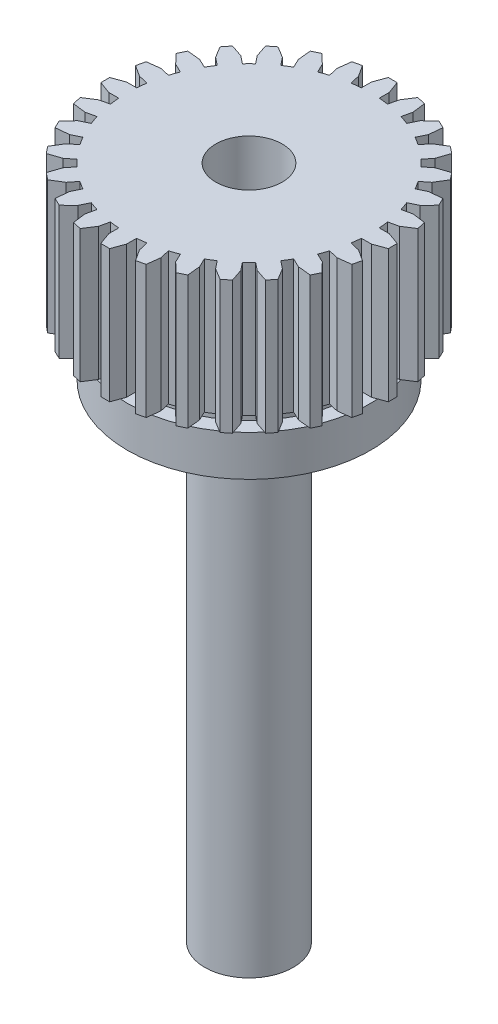
from build123d import *

# Parameters (mm, degrees)
BOSS_EXTRU_1_DEPTH                  = 3
DIAM_TRE_DU_PER_AGE_1_5_1_5_1_D     = 1.5
DIAM_TRE_DU_PER_AGE_1_5_1_5_1_DEPTH = 3


with BuildPart() as part:
    # Esquisse1 → Boss.-Extru.1 (new body)
    with BuildSketch(Plane(origin=(0, -2, 0), x_dir=(1, 0, 0), z_dir=(0, 1, 0))):
        with BuildLine():
            Line((-48.20446184, -20.015127697), (-48.502133602, -20.052430808))
            Line((-48.502133602, -20.052430808), (-48.546637789, -20.247416391))
            Line((-48.546637789, -20.247416391), (-48.294630012, -20.41018027))
            Line((-48.294630012, -20.41018027), (-48.074719557, -20.460373396))
            ThreePointArc((-48.074719557, -20.460373396), (-48.088578558, -20.565214326), (-48.098396333, -20.670510592))
            Line((-48.098396333, -20.670510592), (-48.323962195, -20.670510592))
            Line((-48.323962195, -20.670510592), (-48.605869981, -20.773116635))
            Line((-48.605869981, -20.773116635), (-48.605869981, -20.973116635))
            Line((-48.605869981, -20.973116635), (-48.323962195, -21.075722678))
            Line((-48.323962195, -21.075722678), (-48.098396333, -21.075722678))
            ThreePointArc((-48.098396333, -21.075722678), (-48.088578558, -21.181018944), (-48.074719557, -21.285859874))
            Line((-48.074719557, -21.285859874), (-48.294630012, -21.336053))
            Line((-48.294630012, -21.336053), (-48.546637789, -21.498816879))
            Line((-48.546637789, -21.498816879), (-48.502133602, -21.693802461))
            Line((-48.502133602, -21.693802461), (-48.20446184, -21.731105573))
            Line((-48.20446184, -21.731105573), (-47.984551385, -21.680912447))
            ThreePointArc((-47.984551385, -21.680912447), (-47.951549139, -21.781384055), (-47.914708311, -21.880512486))
            Line((-47.914708311, -21.880512486), (-48.11793613, -21.978381845))
            Line((-48.11793613, -21.978381845), (-48.327407175, -22.1931419))
            Line((-48.327407175, -22.1931419), (-48.240630428, -22.373335674))
            Line((-48.240630428, -22.373335674), (-47.942121195, -22.34346532))
            Line((-47.942121195, -22.34346532), (-47.738893376, -22.24559596))
            ThreePointArc((-47.738893376, -22.24559596), (-47.684361529, -22.336204845), (-47.626386226, -22.424650064))
            Line((-47.626386226, -22.424650064), (-47.802740718, -22.565288078))
            Line((-47.802740718, -22.565288078), (-47.959171279, -22.821275343))
            Line((-47.959171279, -22.821275343), (-47.834473319, -22.977641639))
            Line((-47.834473319, -22.977641639), (-47.550095115, -22.882095644))
            Line((-47.550095115, -22.882095644), (-47.373740623, -22.74145763))
            ThreePointArc((-47.373740623, -22.74145763), (-47.300413629, -22.817660283), (-47.224210976, -22.890987277))
            Line((-47.224210976, -22.890987277), (-47.36484899, -23.067341769))
            Line((-47.36484899, -23.067341769), (-47.460394985, -23.351719973))
            Line((-47.460394985, -23.351719973), (-47.304028689, -23.476417933))
            Line((-47.304028689, -23.476417933), (-47.048041424, -23.319987372))
            Line((-47.048041424, -23.319987372), (-46.90740341, -23.14363288))
            ThreePointArc((-46.90740341, -23.14363288), (-46.818958191, -23.201608183), (-46.728349306, -23.25614003))
            Line((-46.728349306, -23.25614003), (-46.826218666, -23.459367849))
            Line((-46.826218666, -23.459367849), (-46.85608902, -23.757877082))
            Line((-46.85608902, -23.757877082), (-46.675895246, -23.844653829))
            Line((-46.675895246, -23.844653829), (-46.461135191, -23.635182784))
            Line((-46.461135191, -23.635182784), (-46.363265832, -23.431954965))
            ThreePointArc((-46.363265832, -23.431954965), (-46.264137401, -23.468795793), (-46.163665793, -23.501798039))
            Line((-46.163665793, -23.501798039), (-46.213858919, -23.721708494))
            Line((-46.213858919, -23.721708494), (-46.176555807, -24.019380256))
            Line((-46.176555807, -24.019380256), (-45.981570225, -24.063884443))
            Line((-45.981570225, -24.063884443), (-45.818806346, -23.811876666))
            Line((-45.818806346, -23.811876666), (-45.76861322, -23.591966211))
            ThreePointArc((-45.76861322, -23.591966211), (-45.66377229, -23.605825212), (-45.558476024, -23.615642987))
            Line((-45.558476024, -23.615642987), (-45.558476024, -23.841208849))
            Line((-45.558476024, -23.841208849), (-45.455869981, -24.123116635))
            Line((-45.455869981, -24.123116635), (-45.255869981, -24.123116635))
            Line((-45.255869981, -24.123116635), (-45.153263938, -23.841208849))
            Line((-45.153263938, -23.841208849), (-45.153263938, -23.615642987))
            ThreePointArc((-45.153263938, -23.615642987), (-45.047967672, -23.605825212), (-44.943126742, -23.591966211))
            Line((-44.943126742, -23.591966211), (-44.892933616, -23.811876666))
            Line((-44.892933616, -23.811876666), (-44.730169737, -24.063884443))
            Line((-44.730169737, -24.063884443), (-44.535184154, -24.019380256))
            Line((-44.535184154, -24.019380256), (-44.497881043, -23.721708494))
            Line((-44.497881043, -23.721708494), (-44.548074169, -23.501798039))
            ThreePointArc((-44.548074169, -23.501798039), (-44.447602561, -23.468795793), (-44.34847413, -23.431954965))
            Line((-44.34847413, -23.431954965), (-44.25060477, -23.635182784))
            Line((-44.25060477, -23.635182784), (-44.035844716, -23.844653829))
            Line((-44.035844716, -23.844653829), (-43.855650942, -23.757877082))
            Line((-43.855650942, -23.757877082), (-43.885521296, -23.459367849))
            Line((-43.885521296, -23.459367849), (-43.983390655, -23.25614003))
            ThreePointArc((-43.983390655, -23.25614003), (-43.89278177, -23.201608183), (-43.804336552, -23.14363288))
            Line((-43.804336552, -23.14363288), (-43.663698538, -23.319987372))
            Line((-43.663698538, -23.319987372), (-43.407711273, -23.476417933))
            Line((-43.407711273, -23.476417933), (-43.251344977, -23.351719973))
            Line((-43.251344977, -23.351719973), (-43.346890972, -23.067341769))
            Line((-43.346890972, -23.067341769), (-43.487528986, -22.890987277))
            ThreePointArc((-43.487528986, -22.890987277), (-43.411326333, -22.817660283), (-43.337999339, -22.74145763))
            Line((-43.337999339, -22.74145763), (-43.161644847, -22.882095644))
            Line((-43.161644847, -22.882095644), (-42.877266643, -22.977641639))
            Line((-42.877266643, -22.977641639), (-42.752568683, -22.821275343))
            Line((-42.752568683, -22.821275343), (-42.908999244, -22.565288078))
            Line((-42.908999244, -22.565288078), (-43.085353736, -22.424650064))
            ThreePointArc((-43.085353736, -22.424650064), (-43.027378433, -22.336204845), (-42.972846586, -22.24559596))
            Line((-42.972846586, -22.24559596), (-42.769618767, -22.34346532))
            Line((-42.769618767, -22.34346532), (-42.471109534, -22.373335674))
            Line((-42.471109534, -22.373335674), (-42.384332786, -22.1931419))
            Line((-42.384332786, -22.1931419), (-42.593803832, -21.978381845))
            Line((-42.593803832, -21.978381845), (-42.797031651, -21.880512486))
            ThreePointArc((-42.797031651, -21.880512486), (-42.760190823, -21.781384055), (-42.727188576, -21.680912447))
            Line((-42.727188576, -21.680912447), (-42.507278122, -21.731105573))
            Line((-42.507278122, -21.731105573), (-42.20960636, -21.693802461))
            Line((-42.20960636, -21.693802461), (-42.165102173, -21.498816879))
            Line((-42.165102173, -21.498816879), (-42.41710995, -21.336053))
            Line((-42.41710995, -21.336053), (-42.637020405, -21.285859874))
            ThreePointArc((-42.637020405, -21.285859874), (-42.623161404, -21.181018944), (-42.613343629, -21.075722678))
            Line((-42.613343629, -21.075722678), (-42.387777767, -21.075722678))
            Line((-42.387777767, -21.075722678), (-42.105869981, -20.973116635))
            Line((-42.105869981, -20.973116635), (-42.105869981, -20.773116635))
            Line((-42.105869981, -20.773116635), (-42.387777767, -20.670510592))
            Line((-42.387777767, -20.670510592), (-42.613343629, -20.670510592))
            ThreePointArc((-42.613343629, -20.670510592), (-42.623161404, -20.565214326), (-42.637020405, -20.460373396))
            Line((-42.637020405, -20.460373396), (-42.41710995, -20.41018027))
            Line((-42.41710995, -20.41018027), (-42.165102173, -20.247416391))
            Line((-42.165102173, -20.247416391), (-42.20960636, -20.052430808))
            Line((-42.20960636, -20.052430808), (-42.507278122, -20.015127697))
            Line((-42.507278122, -20.015127697), (-42.727188576, -20.065320823))
            ThreePointArc((-42.727188576, -20.065320823), (-42.760190823, -19.964849214), (-42.797031651, -19.865720784))
            Line((-42.797031651, -19.865720784), (-42.593803832, -19.767851424))
            Line((-42.593803832, -19.767851424), (-42.384332786, -19.553091369))
            Line((-42.384332786, -19.553091369), (-42.471109534, -19.372897596))
            Line((-42.471109534, -19.372897596), (-42.769618767, -19.40276795))
            Line((-42.769618767, -19.40276795), (-42.972846586, -19.500637309))
            ThreePointArc((-42.972846586, -19.500637309), (-43.027378433, -19.410028424), (-43.085353736, -19.321583206))
            Line((-43.085353736, -19.321583206), (-42.908999244, -19.180945191))
            Line((-42.908999244, -19.180945191), (-42.752568683, -18.924957927))
            Line((-42.752568683, -18.924957927), (-42.877266643, -18.768591631))
            Line((-42.877266643, -18.768591631), (-43.161644847, -18.864137626))
            Line((-43.161644847, -18.864137626), (-43.337999339, -19.00477564))
            ThreePointArc((-43.337999339, -19.00477564), (-43.411326333, -18.928572987), (-43.487528986, -18.855245993))
            Line((-43.487528986, -18.855245993), (-43.346890972, -18.678891501))
            Line((-43.346890972, -18.678891501), (-43.251344977, -18.394513297))
            Line((-43.251344977, -18.394513297), (-43.407711273, -18.269815337))
            Line((-43.407711273, -18.269815337), (-43.663698538, -18.426245898))
            Line((-43.663698538, -18.426245898), (-43.804336552, -18.60260039))
            ThreePointArc((-43.804336552, -18.60260039), (-43.89278177, -18.544625087), (-43.983390655, -18.49009324))
            Line((-43.983390655, -18.49009324), (-43.885521296, -18.286865421))
            Line((-43.885521296, -18.286865421), (-43.855650942, -17.988356188))
            Line((-43.855650942, -17.988356188), (-44.035844716, -17.90157944))
            Line((-44.035844716, -17.90157944), (-44.25060477, -18.111050486))
            Line((-44.25060477, -18.111050486), (-44.34847413, -18.314278305))
            ThreePointArc((-44.34847413, -18.314278305), (-44.447602561, -18.277437476), (-44.548074169, -18.24443523))
            Line((-44.548074169, -18.24443523), (-44.497881043, -18.024524776))
            Line((-44.497881043, -18.024524776), (-44.535184154, -17.726853014))
            Line((-44.535184154, -17.726853014), (-44.730169737, -17.682348827))
            Line((-44.730169737, -17.682348827), (-44.892933616, -17.934356604))
            Line((-44.892933616, -17.934356604), (-44.943126742, -18.154267058))
            ThreePointArc((-44.943126742, -18.154267058), (-45.047967672, -18.140408058), (-45.153263938, -18.130590283))
            Line((-45.153263938, -18.130590283), (-45.153263938, -17.905024421))
            Line((-45.153263938, -17.905024421), (-45.255869981, -17.623116635))
            Line((-45.255869981, -17.623116635), (-45.455869981, -17.623116635))
            Line((-45.455869981, -17.623116635), (-45.558476024, -17.905024421))
            Line((-45.558476024, -17.905024421), (-45.558476024, -18.130590283))
            ThreePointArc((-45.558476024, -18.130590283), (-45.66377229, -18.140408058), (-45.76861322, -18.154267058))
            Line((-45.76861322, -18.154267058), (-45.818806346, -17.934356604))
            Line((-45.818806346, -17.934356604), (-45.981570225, -17.682348827))
            Line((-45.981570225, -17.682348827), (-46.176555807, -17.726853014))
            Line((-46.176555807, -17.726853014), (-46.213858919, -18.024524776))
            Line((-46.213858919, -18.024524776), (-46.163665793, -18.24443523))
            ThreePointArc((-46.163665793, -18.24443523), (-46.264137401, -18.277437476), (-46.363265832, -18.314278305))
            Line((-46.363265832, -18.314278305), (-46.461135191, -18.111050486))
            Line((-46.461135191, -18.111050486), (-46.675895246, -17.90157944))
            Line((-46.675895246, -17.90157944), (-46.85608902, -17.988356188))
            Line((-46.85608902, -17.988356188), (-46.826218666, -18.286865421))
            Line((-46.826218666, -18.286865421), (-46.728349306, -18.49009324))
            ThreePointArc((-46.728349306, -18.49009324), (-46.818958191, -18.544625087), (-46.90740341, -18.60260039))
            Line((-46.90740341, -18.60260039), (-47.048041424, -18.426245898))
            Line((-47.048041424, -18.426245898), (-47.304028689, -18.269815337))
            Line((-47.304028689, -18.269815337), (-47.460394985, -18.394513297))
            Line((-47.460394985, -18.394513297), (-47.36484899, -18.678891501))
            Line((-47.36484899, -18.678891501), (-47.224210976, -18.855245993))
            ThreePointArc((-47.224210976, -18.855245993), (-47.300413629, -18.928572987), (-47.373740623, -19.00477564))
            Line((-47.373740623, -19.00477564), (-47.550095115, -18.864137626))
            Line((-47.550095115, -18.864137626), (-47.834473319, -18.768591631))
            Line((-47.834473319, -18.768591631), (-47.959171279, -18.924957927))
            Line((-47.959171279, -18.924957927), (-47.802740718, -19.180945191))
            Line((-47.802740718, -19.180945191), (-47.626386226, -19.321583206))
            ThreePointArc((-47.626386226, -19.321583206), (-47.684361529, -19.410028424), (-47.738893376, -19.500637309))
            Line((-47.738893376, -19.500637309), (-47.942121195, -19.40276795))
            Line((-47.942121195, -19.40276795), (-48.240630428, -19.372897596))
            Line((-48.240630428, -19.372897596), (-48.327407175, -19.553091369))
            Line((-48.327407175, -19.553091369), (-48.11793613, -19.767851424))
            Line((-48.11793613, -19.767851424), (-47.914708311, -19.865720784))
            ThreePointArc((-47.914708311, -19.865720784), (-47.951549139, -19.964849214), (-47.984551385, -20.065320823))
            Line((-47.984551385, -20.065320823), (-48.20446184, -20.015127697))
        make_face()
    extrude(amount=-BOSS_EXTRU_1_DEPTH)

    # Esquisse2 → Révolution1 (revolve)
    with BuildSketch(Plane(origin=(0, 0, 20.873116635), x_dir=(-1, 0, 0), z_dir=(0, 0, -1)), mode=Mode.PRIVATE) as r_volution1_sk:
        Polygon((44.355869981, -17.25), (45.355869981, -17.25), (45.355869981, -5), (42.935239006, -5), (42.935239006, -5.330573614), (42.605869981, -5.330573614), (42.605869981, -6.25), (44.354296823, -6.25), (44.354296823, -7.25), (44.355869981, -7.25), align=None)
    revolve(r_volution1_sk.sketch.rotate(Axis((-45.355869981, -17.25, 20.873116635), (0, 1, 0)), 270), axis=Axis((-45.355869981, -17.25, 20.873116635), (0, 1, 0)))

    # Diamètre du perçage Ø1.5 (1.5)1
    with Locations(Plane(origin=(0, -2, 0), x_dir=(1, 0, 0), z_dir=(0, 1, 0))):
        with Locations((-45.355869981, -20.873116635)):
            Hole(DIAM_TRE_DU_PER_AGE_1_5_1_5_1_D / 2, depth=DIAM_TRE_DU_PER_AGE_1_5_1_5_1_DEPTH)


solid = part.part
